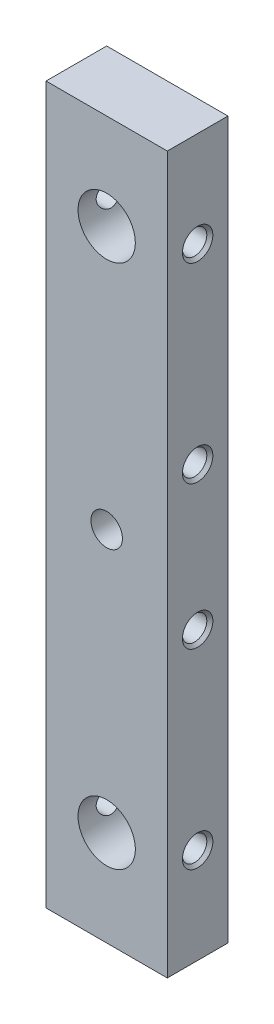
from build123d import *

# Parameters (mm, degrees)
CROQUIS1_W                         = 25.4
CROQUIS1_H                         = 150
CROQUIS1_R                         = 6
SALIENTE_EXTRUIR1_DEPTH            = 6.35
TALADRO_ROSCADO_1_4_201_AT_2_COUNT = 2
TALADRO_ROSCADO_1_4_201_AT_2_PITCH = 30
TALADRO_ROSCADO_1_4_202_AT_2_COUNT = 2
TALADRO_ROSCADO_1_4_202_AT_2_PITCH = 110
TALADRO_DE_MARGEN_PARA_1_D         = 6.6


with BuildPart() as part:
    # Croquis1 → Saliente-Extruir1 (new, symmetric)
    with BuildSketch(Plane.XY):
        Rectangle(CROQUIS1_W, CROQUIS1_H)
        with Locations((0, 55)):
            Circle(CROQUIS1_R, mode=Mode.SUBTRACT)
        with Locations(Location((0, -55, 0), (0, 0, 180))):
            Circle(CROQUIS1_R, mode=Mode.SUBTRACT)
    extrude(amount=SALIENTE_EXTRUIR1_DEPTH, both=True)

    # Croquis3 → Taladro roscado 1/4-201 (revolve, cut)
    with BuildSketch(Plane(origin=(-12.7, -15, 0), x_dir=(0, 0, 1), z_dir=(0, 1, 0))):
        Polygon((0, 0), (0, 25.4), (3.1877, 25.4), (2.5527, 24.765), (2.5527, 0.635), (3.1877, 0), align=None)
    taladro_roscado_1_4_201 = revolve(axis=Axis((-19.05, -15, 0), (1, 0, 0)), mode=Mode.SUBTRACT)

    # Taladro roscado 1/4-201 at 2: Taladro roscado 1/4-201 ×2
    with Locations(*[(0, i * TALADRO_ROSCADO_1_4_201_AT_2_PITCH, 0) for i in range(1, TALADRO_ROSCADO_1_4_201_AT_2_COUNT)]):
        add(taladro_roscado_1_4_201, mode=Mode.SUBTRACT)

    # Croquis7 → Taladro roscado 1/4-202 (revolve, cut)
    with BuildSketch(Plane(origin=(-12.7, 55, 0), x_dir=(0, 0, 1), z_dir=(0, 1, 0))):
        Polygon((0, 0), (0, 25.4), (3.1877, 25.4), (2.5527, 24.765), (2.5527, 0.635), (3.1877, 0), align=None)
    taladro_roscado_1_4_202 = revolve(axis=Axis((-19.05, 55, 0), (1, 0, 0)), mode=Mode.SUBTRACT)

    # Taladro roscado 1/4-202 at 2: Taladro roscado 1/4-202 ×2
    with Locations(*[(0, -i * TALADRO_ROSCADO_1_4_202_AT_2_PITCH, 0) for i in range(1, TALADRO_ROSCADO_1_4_202_AT_2_COUNT)]):
        add(taladro_roscado_1_4_202, mode=Mode.SUBTRACT)

    # Taladro de margen para 1 (through all)
    with Locations(Plane.XY.offset(6.35)):
        with Locations((0, 0)):
            Hole(TALADRO_DE_MARGEN_PARA_1_D / 2)


solid = part.part
